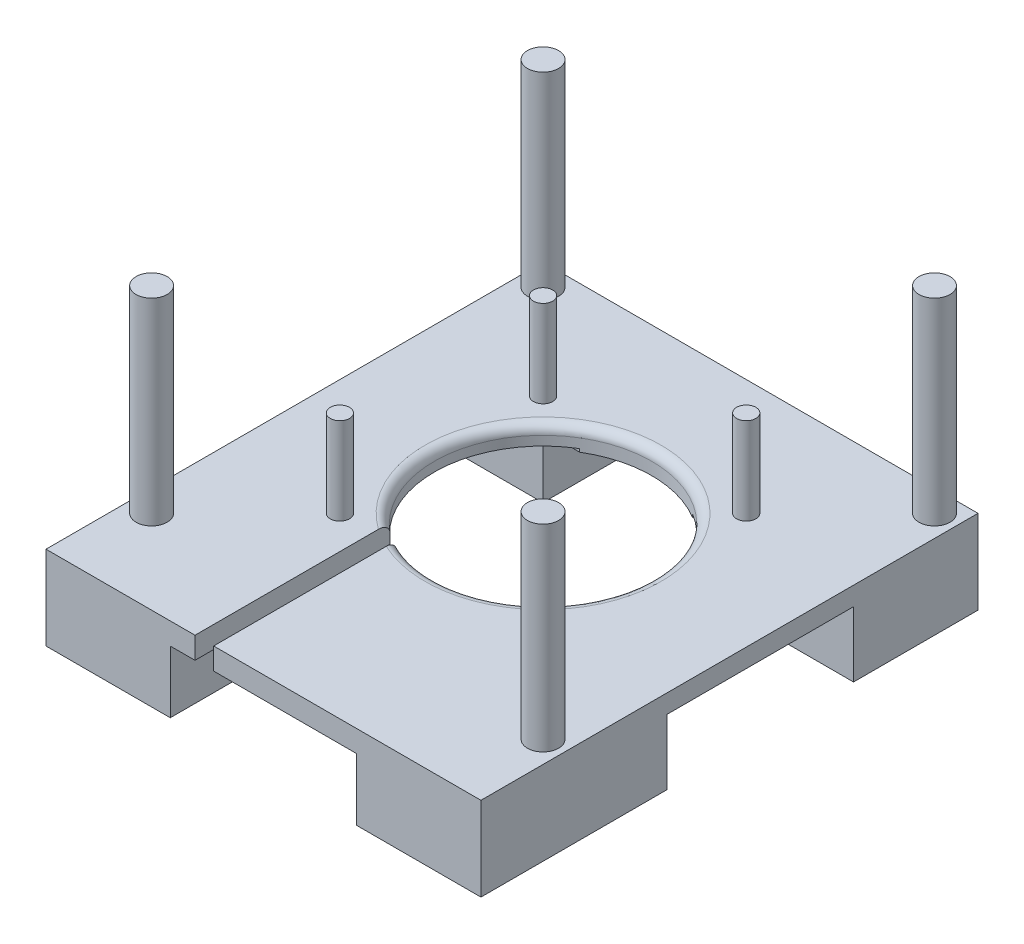
from build123d import *

# Parameters (mm, degrees)
SKETCH1_W           = 70
SKETCH1_H           = 70
BOSS_EXTRUDE1_DEPTH = 13.5
SKETCH5_R           = 1.55
FANS_COLUMN_DEPTH   = 14
SKETCH6_R           = 17.5
CUT_EXTRUDE2_DEPTH  = 15
FILLET1_R           = 1.5
SKETCH7_R           = 2.5
BOSS_EXTRUDE4_DEPTH = 31.75
SKETCH8_W           = 3
SKETCH8_H           = 4
CUT_EXTRUDE3_DEPTH  = 22
BOSS_EXTRUDE5_DEPTH = 10
SKETCH10_W          = 30
SKETCH10_H          = 10.5
CUT_EXTRUDE4_DEPTH  = 95.723611148
SKETCH11_W          = 30
SKETCH11_H          = 10
CUT_EXTRUDE5_DEPTH  = 99.349186657


with BuildPart() as part:
    # Sketch1 → Boss-Extrude1 (new body)
    with BuildSketch(Plane(origin=(0, 0, 0), x_dir=(1, 0, 0), z_dir=(0, 1, 0))):
        Rectangle(SKETCH1_W, SKETCH1_H)
    extrude(amount=BOSS_EXTRUDE1_DEPTH)

    # Sketch5 → Fans_Column (add)
    with BuildSketch(Plane(origin=(0, 13.5, 0), x_dir=(1, 0, 0), z_dir=(0, 1, 0))):
        with Locations(Location((-16.35, 16.35, 0), (0, 0, 90))):
            Circle(SKETCH5_R)
        with Locations(Location((16.35, 16.35, 0), (0, 0, 90))):
            Circle(SKETCH5_R)
        with Locations(Location((16.35, -16.35, 0), (0, 0, 90))):
            Circle(SKETCH5_R)
        with Locations(Location((-16.35, -16.35, 0), (0, 0, 90))):
            Circle(SKETCH5_R)
    extrude(amount=FANS_COLUMN_DEPTH)

    # Sketch6 → Cut-Extrude2 (cut)
    with BuildSketch(Plane(origin=(0, 13.5, 0), x_dir=(1, 0, 0), z_dir=(0, 1, 0))):
        with Locations(Location((0, 0, 0), (0, 0, 270))):
            Circle(SKETCH6_R)
    extrude(amount=-CUT_EXTRUDE2_DEPTH, mode=Mode.SUBTRACT)

    # Fillet1
    fillet1_edges = [part.edges().sort_by_distance(p)[0] for p in [
        (0, 13.5, -17.5),
    ]]
    fillet(fillet1_edges, radius=FILLET1_R)

    # Sketch7 → Boss-Extrude4 (add)
    with BuildSketch(Plane(origin=(0, 13.5, 0), x_dir=(1, 0, 0), z_dir=(0, 1, 0))):
        with Locations(Location((-31.5, -31.5, 0), (0, 0, 270))):
            Circle(SKETCH7_R)
        with Locations(Location((-31.5, 31.5, 0), (0, 0, 90))):
            Circle(SKETCH7_R)
        with Locations(Location((31.5, 31.5, 0), (0, 0, 270))):
            Circle(SKETCH7_R)
        with Locations(Location((31.5, -31.5, 0), (0, 0, 90))):
            Circle(SKETCH7_R)
    extrude(amount=BOSS_EXTRUDE4_DEPTH)

    # Sketch8 → Cut-Extrude3 (cut)
    with BuildSketch(Plane.XY.offset(35)):
        with Locations((-9.518750433, 11.5)):
            Rectangle(SKETCH8_W, SKETCH8_H)
    extrude(amount=-CUT_EXTRUDE3_DEPTH, mode=Mode.SUBTRACT)

    # Sketch9 → Boss-Extrude5 (add)
    with BuildSketch(Plane.XY.offset(35)):
        Polygon((-8.018750433, 9.5), (-11.018750433, 9.5), (-11.018750433, 13.5), (-35, 13.5), (-35, 0), (35, 0), (35, 13.5), (-8.018750433, 13.5), align=None)
    extrude(amount=BOSS_EXTRUDE5_DEPTH)

    # Sketch10 → Cut-Extrude4 (cut, through all)
    with BuildSketch(Plane.ZY.offset(35)):
        with Locations((0.031213212, 5.25)):
            Rectangle(SKETCH10_W, SKETCH10_H)
    extrude(amount=-CUT_EXTRUDE4_DEPTH, mode=Mode.SUBTRACT)

    # Sketch11 → Cut-Extrude5 (cut, through all)
    with BuildSketch(Plane(origin=(0, 0, -35), x_dir=(-1, 0, 0), z_dir=(0, 0, -1))):
        with Locations((0, 5)):
            Rectangle(SKETCH11_W, SKETCH11_H)
    extrude(amount=-CUT_EXTRUDE5_DEPTH, mode=Mode.SUBTRACT)


solid = part.part
